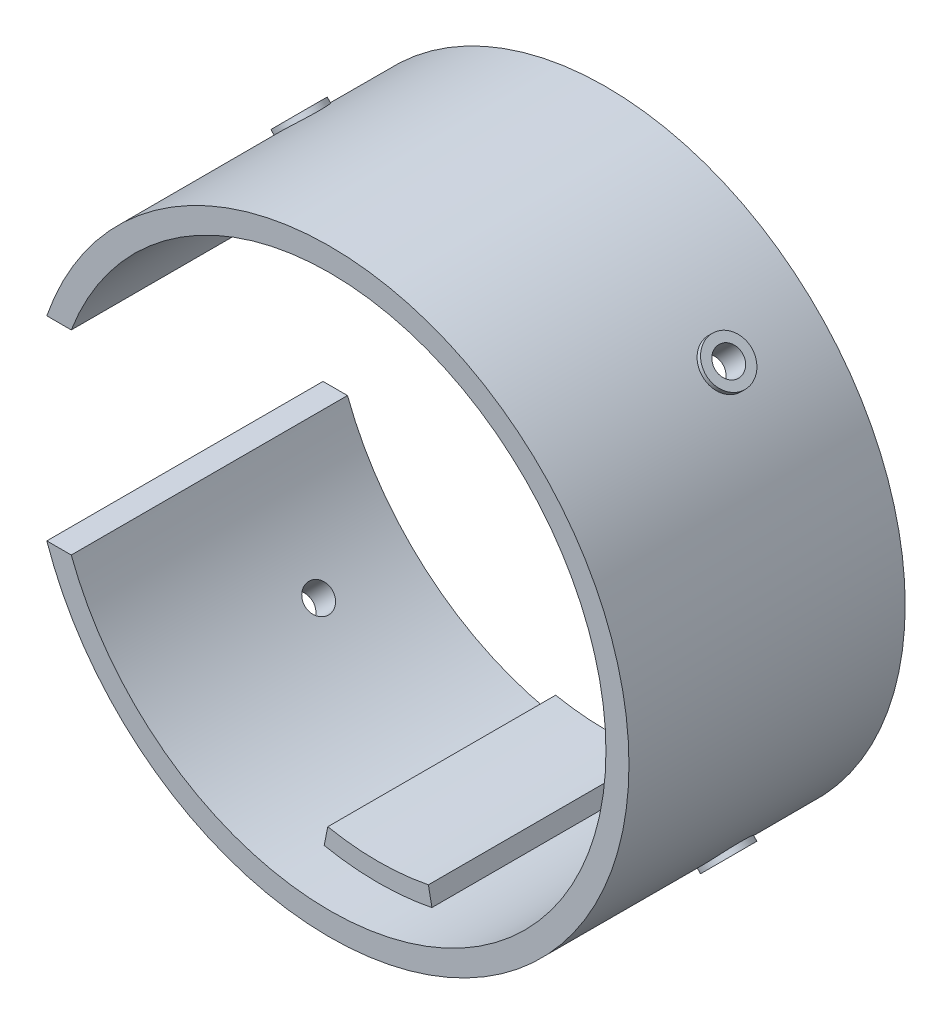
from build123d import *

# Parameters (mm, degrees)
BOSS_EXTRUDE1_DEPTH     = 36
BOSS_EXTRUDE2_DEPTH     = 29.7
BOSS_EXTRUDE2_2_DEPTH   = 29.7
SKETCH3_R               = 3
BOSS_EXTRUDE3_DEPTH     = 1.8
CUT_EXTRUDE1_REACH      = 103.362
CUT_EXTRUDE1_END_RADIUS = 36
SKETCH4_R               = 1.8
CIRPATTERN1_COUNT       = 4


with BuildPart() as part:
    # Sketch1 → Boss-Extrude1 (new body)
    with BuildSketch(Plane.XY):
        with BuildLine():
            Line((-33.685456803, 12.7), (-36.874245755, 12.7))
            ThreePointArc((-36.874245755, 12.7), (39, 0), (-36.874245755, -12.7))
            Line((-36.874245755, -12.7), (-33.685456803, -12.7))
            ThreePointArc((-33.685456803, -12.7), (36, 0), (-33.685456803, 12.7))
        make_face()
    extrude(amount=BOSS_EXTRUDE1_DEPTH)

    # Sketch3 → Boss-Extrude3 (add)
    with BuildSketch(Plane(origin=(-26.728262307, 26.728262307, 0), x_dir=(0, 0, -1), z_dir=(0.7071067811865464, -0.7071067811865488, 0))):
        with Locations(Location((-12, 0, 0), (0, 0, 90))):
            Circle(SKETCH3_R)
    boss_extrude3 = extrude(amount=-BOSS_EXTRUDE3_DEPTH)

    # Cut-Extrude1: up to this cylinder (the profile starts outside it)
    cut_extrude1_end = Plane(origin=(0, 0, 12), z_dir=(0, 0, -1)) * Cylinder(CUT_EXTRUDE1_END_RADIUS, 279.724, mode=Mode.PRIVATE)
    # Sketch4 → Cut-Extrude1 (cut, up to the surface)
    with BuildSketch(Plane(origin=(-28.001054513, 28.001054513, 0), x_dir=(0, 0, 1), z_dir=(-0.7071067811865465, 0.7071067811865487, 0)), mode=Mode.PRIVATE) as cut_extrude1_sk1:
        with Locations(Location((12, 0, 0), (0, 0, 270))):
            Circle(SKETCH4_R)
    cut_extrude1_tool1 = extrude(cut_extrude1_sk1.sketch, amount=-CUT_EXTRUDE1_REACH, mode=Mode.PRIVATE) - cut_extrude1_end
    cut_extrude1 = cut_extrude1_tool1.solids().sort_by_distance((-28.001055, 28.001055, 12))[0]
    add(cut_extrude1, mode=Mode.SUBTRACT)

    # CirPattern1: Boss-Extrude3, Cut-Extrude1 ×4 about axis
    cirpattern1_axis = Axis((0, 0, 0), (0, 0, 1))
    add([boss_extrude3.rotate(cirpattern1_axis, i * 360 / CIRPATTERN1_COUNT) for i in range(1, CIRPATTERN1_COUNT)])
    add([cut_extrude1.rotate(cirpattern1_axis, i * 360 / CIRPATTERN1_COUNT) for i in range(1, CIRPATTERN1_COUNT)], mode=Mode.SUBTRACT)


with BuildPart() as body_2:
    # Sketch2 → Boss-Extrude2 (new body)
    with BuildSketch(Plane(origin=(0, 0, 0), x_dir=(-1, 0, 0), z_dir=(0, 0, -1))):
        with BuildLine():
            Line((-7.023251593, 35.308270095), (-6.55503482, 32.954385422))
            ThreePointArc((-6.55503482, 32.954385422), (0, 33.6), (6.55503482, 32.954385422))
            Line((6.55503482, 32.954385422), (7.023251593, 35.308270095))
            ThreePointArc((7.023251593, 35.308270095), (0, 36), (-7.023251593, 35.308270095))
        make_face()
    extrude(amount=-BOSS_EXTRUDE2_DEPTH)


with BuildPart() as body_3:
    # Sketch2 → Boss-Extrude2 2 (new body)
    with BuildSketch(Plane(origin=(0, 0, 0), x_dir=(-1, 0, 0), z_dir=(0, 0, -1))):
        with BuildLine():
            Line((7.023251593, -35.308270095), (6.55503482, -32.954385422))
            ThreePointArc((6.55503482, -32.954385422), (0, -33.6), (-6.55503482, -32.954385422))
            Line((-6.55503482, -32.954385422), (-7.023251593, -35.308270095))
            ThreePointArc((-7.023251593, -35.308270095), (0, -36), (7.023251593, -35.308270095))
        make_face()
    extrude(amount=-BOSS_EXTRUDE2_2_DEPTH)


solid = Compound([part.part, body_2.part, body_3.part])
